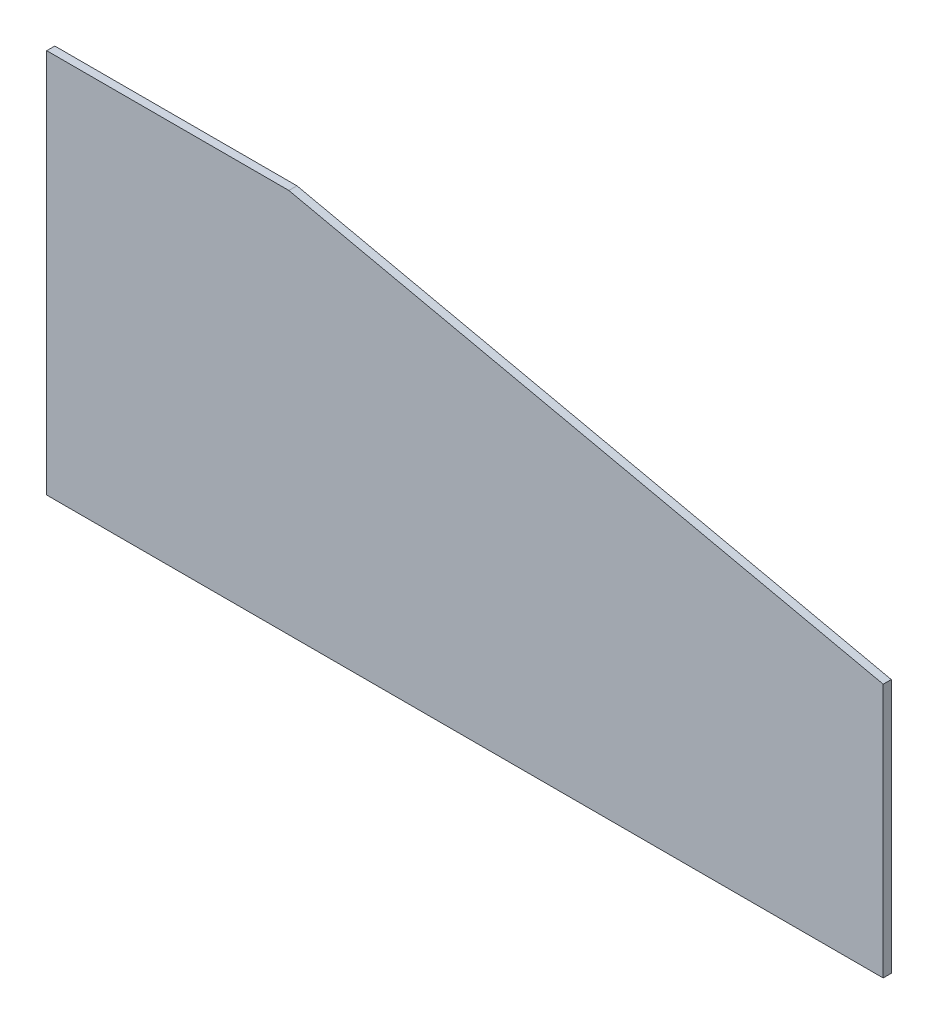
from build123d import *

# Parameters (mm, degrees)
BOSS_EXTRUDE1_DEPTH = 12.7


with BuildPart() as part:
    # Sketch1 → Boss-Extrude1 (new body)
    with BuildSketch(Plane.XY):
        Polygon((0, 0), (0, 605), (380.662838908, 605), (1315, 400), (1315, 0), align=None)
    extrude(amount=BOSS_EXTRUDE1_DEPTH)


solid = part.part
